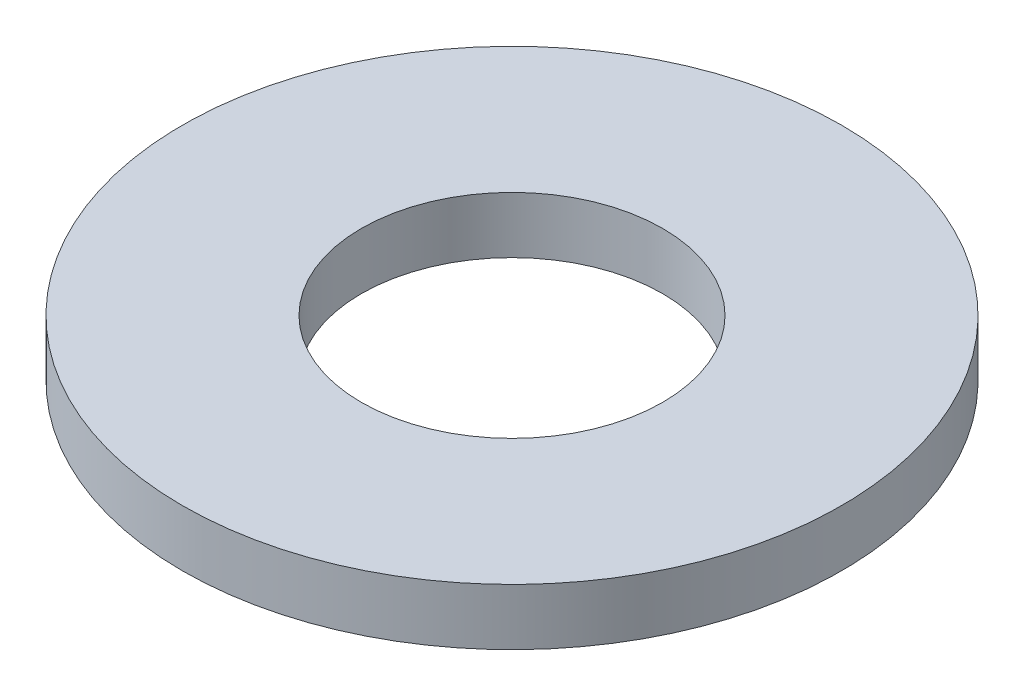
from build123d import *

# Parameters (mm, degrees)
SKETCH1_R           = 17.5
SKETCH1_R_2         = 8
BOSS_EXTRUDE1_DEPTH = 3


with BuildPart() as part:
    # Sketch1 → Boss-Extrude1 (new body)
    with BuildSketch(Plane(origin=(0, 0, 0), x_dir=(1, 0, 0), z_dir=(0, 1, 0))):
        with Locations(Location((0, 0, 0), (0, 0, 270))):
            Circle(SKETCH1_R)
        with Locations(Location((0, 0, 0), (0, 0, 270))):
            Circle(SKETCH1_R_2, mode=Mode.SUBTRACT)
    extrude(amount=BOSS_EXTRUDE1_DEPTH)


solid = part.part
